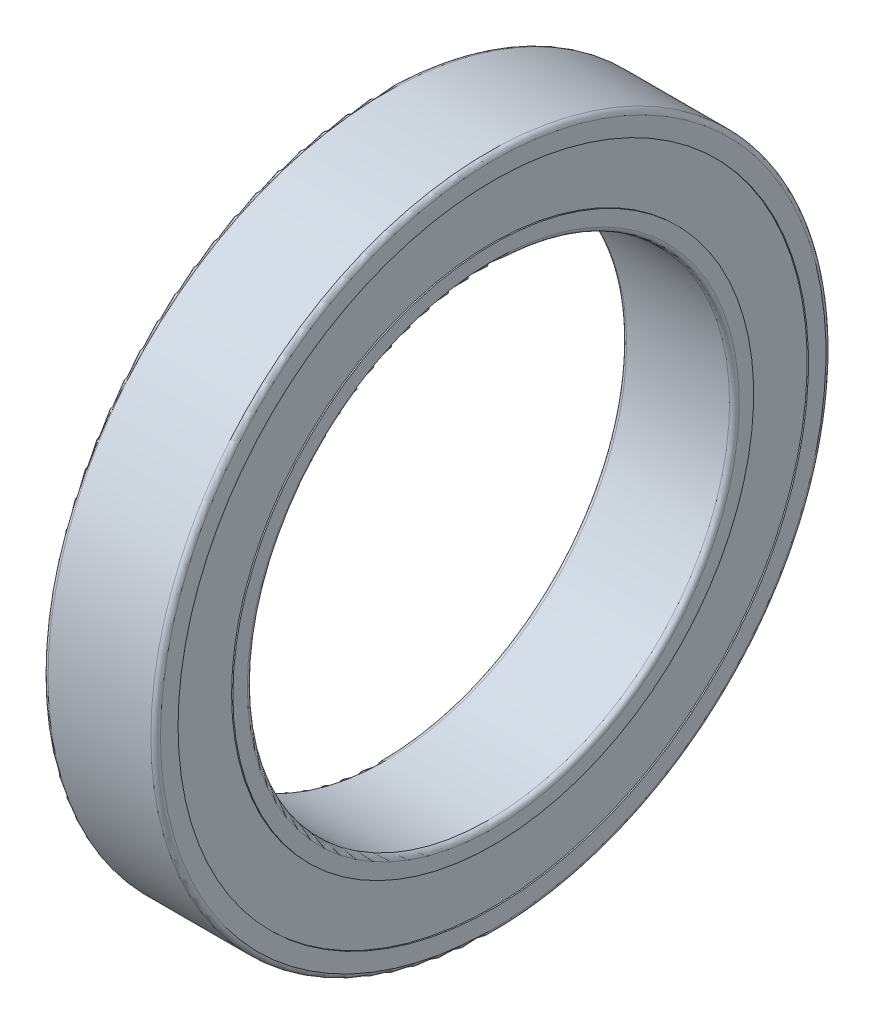
from build123d import *

# Parameters (mm, degrees)
SKETCH_3_W               = 0.2415
SKETCH_3_H               = 3.41
PATTERN_CIRCULAR_2_COUNT = 13


with BuildPart() as part:
    # ｽｹｯﾁ1 → 回転1 (revolve)
    with BuildSketch(Plane.XY, mode=Mode.PRIVATE) as revolve_1_sk:
        with BuildLine():
            Line((-3.2, 21), (3.2, 21))
            ThreePointArc((3.2, 21), (3.412132034, 20.912132034), (3.5, 20.7))
            Line((3.5, 20.7), (3.5, 19.61))
            Line((3.5, 19.61), (3.178, 19.61))
            Line((3.178, 19.61), (3.178, 19.1))
            Line((3.178, 19.1), (1.019803903, 19.1))
            ThreePointArc((1.019803903, 19.1), (0, 19.5), (-1.019803903, 19.1))
            Line((-1.019803903, 19.1), (-3.178, 19.1))
            Line((-3.178, 19.1), (-3.178, 19.61))
            Line((-3.178, 19.61), (-3.5, 19.61))
            Line((-3.5, 19.61), (-3.5, 20.7))
            ThreePointArc((-3.5, 20.7), (-3.412132034, 20.912132034), (-3.2, 21))
        make_face()
        with BuildLine():
            Line((-3.178, 16.7), (-0.748331477, 16.7))
            ThreePointArc((-0.748331477, 16.7), (0, 16.5), (0.748331477, 16.7))
            Line((0.748331477, 16.7), (3.178, 16.7))
            Line((3.178, 16.7), (3.178, 16.2))
            Line((3.178, 16.2), (3.5, 16.2))
            Line((3.5, 16.2), (3.5, 15.3))
            ThreePointArc((3.5, 15.3), (3.412132034, 15.087867966), (3.2, 15))
            Line((3.2, 15), (-3.2, 15))
            ThreePointArc((-3.2, 15), (-3.412132034, 15.087867966), (-3.5, 15.3))
            Line((-3.5, 15.3), (-3.5, 16.2))
            Line((-3.5, 16.2), (-3.178, 16.2))
            Line((-3.178, 16.2), (-3.178, 16.7))
        make_face()
    revolve(revolve_1_sk.sketch.rotate(Axis((0, 0, 0), (1, 0, 0)), 90), axis=Axis((0, 0, 0), (1, 0, 0)))


with BuildPart() as body_2:
    # ｽｹｯﾁ3 → 回転3 (revolve)
    with BuildSketch(Plane.XY, mode=Mode.PRIVATE) as revolve_3_sk:
        with Locations((3.29875, 17.905)):
            Rectangle(SKETCH_3_W, SKETCH_3_H)
        with Locations((-3.29875, 17.905)):
            Rectangle(SKETCH_3_W, SKETCH_3_H)
    revolve(revolve_3_sk.sketch.rotate(Axis((0, 0, 0), (1, 0, 0)), 90), axis=Axis((0, 0, 0), (1, 0, 0)))


with BuildPart() as body_3:
    # ｽｹｯﾁ2 → 回転2 (revolve)
    with BuildSketch(Plane.XY):
        with BuildLine():
            Line((-1.5, 18), (1.5, 18))
            ThreePointArc((1.5, 18), (0, 19.5), (-1.5, 18))
        make_face()
    revolve(axis=Axis((0.04685524, 18, 0), (1, 0, 0)))


with BuildPart() as pattern_circular_2_1:
    # 円形ﾊﾟﾀｰﾝ2: pattern copy
    add(body_3.part.rotate(Axis((0, 0, 0), (1, 0, 0)), 1 * 360 / PATTERN_CIRCULAR_2_COUNT))


with BuildPart() as pattern_circular_2_2:
    # 円形ﾊﾟﾀｰﾝ2: pattern copy
    add(body_3.part.rotate(Axis((0, 0, 0), (1, 0, 0)), 2 * 360 / PATTERN_CIRCULAR_2_COUNT))


with BuildPart() as pattern_circular_2_3:
    # 円形ﾊﾟﾀｰﾝ2: pattern copy
    add(body_3.part.rotate(Axis((0, 0, 0), (1, 0, 0)), 3 * 360 / PATTERN_CIRCULAR_2_COUNT))


with BuildPart() as pattern_circular_2_4:
    # 円形ﾊﾟﾀｰﾝ2: pattern copy
    add(body_3.part.rotate(Axis((0, 0, 0), (1, 0, 0)), 4 * 360 / PATTERN_CIRCULAR_2_COUNT))


with BuildPart() as pattern_circular_2_5:
    # 円形ﾊﾟﾀｰﾝ2: pattern copy
    add(body_3.part.rotate(Axis((0, 0, 0), (1, 0, 0)), 5 * 360 / PATTERN_CIRCULAR_2_COUNT))


with BuildPart() as pattern_circular_2_6:
    # 円形ﾊﾟﾀｰﾝ2: pattern copy
    add(body_3.part.rotate(Axis((0, 0, 0), (1, 0, 0)), 6 * 360 / PATTERN_CIRCULAR_2_COUNT))


with BuildPart() as pattern_circular_2_7:
    # 円形ﾊﾟﾀｰﾝ2: pattern copy
    add(body_3.part.rotate(Axis((0, 0, 0), (1, 0, 0)), 7 * 360 / PATTERN_CIRCULAR_2_COUNT))


with BuildPart() as pattern_circular_2_8:
    # 円形ﾊﾟﾀｰﾝ2: pattern copy
    add(body_3.part.rotate(Axis((0, 0, 0), (1, 0, 0)), 8 * 360 / PATTERN_CIRCULAR_2_COUNT))


with BuildPart() as pattern_circular_2_9:
    # 円形ﾊﾟﾀｰﾝ2: pattern copy
    add(body_3.part.rotate(Axis((0, 0, 0), (1, 0, 0)), 9 * 360 / PATTERN_CIRCULAR_2_COUNT))


with BuildPart() as pattern_circular_2_10:
    # 円形ﾊﾟﾀｰﾝ2: pattern copy
    add(body_3.part.rotate(Axis((0, 0, 0), (1, 0, 0)), 10 * 360 / PATTERN_CIRCULAR_2_COUNT))


with BuildPart() as pattern_circular_2_11:
    # 円形ﾊﾟﾀｰﾝ2: pattern copy
    add(body_3.part.rotate(Axis((0, 0, 0), (1, 0, 0)), 11 * 360 / PATTERN_CIRCULAR_2_COUNT))


with BuildPart() as pattern_circular_2_12:
    # 円形ﾊﾟﾀｰﾝ2: pattern copy
    add(body_3.part.rotate(Axis((0, 0, 0), (1, 0, 0)), 12 * 360 / PATTERN_CIRCULAR_2_COUNT))


solid = Compound([part.part, body_2.part, body_3.part, pattern_circular_2_1.part, pattern_circular_2_2.part, pattern_circular_2_3.part, pattern_circular_2_4.part, pattern_circular_2_5.part, pattern_circular_2_6.part, pattern_circular_2_7.part, pattern_circular_2_8.part, pattern_circular_2_9.part, pattern_circular_2_10.part, pattern_circular_2_11.part, pattern_circular_2_12.part])
